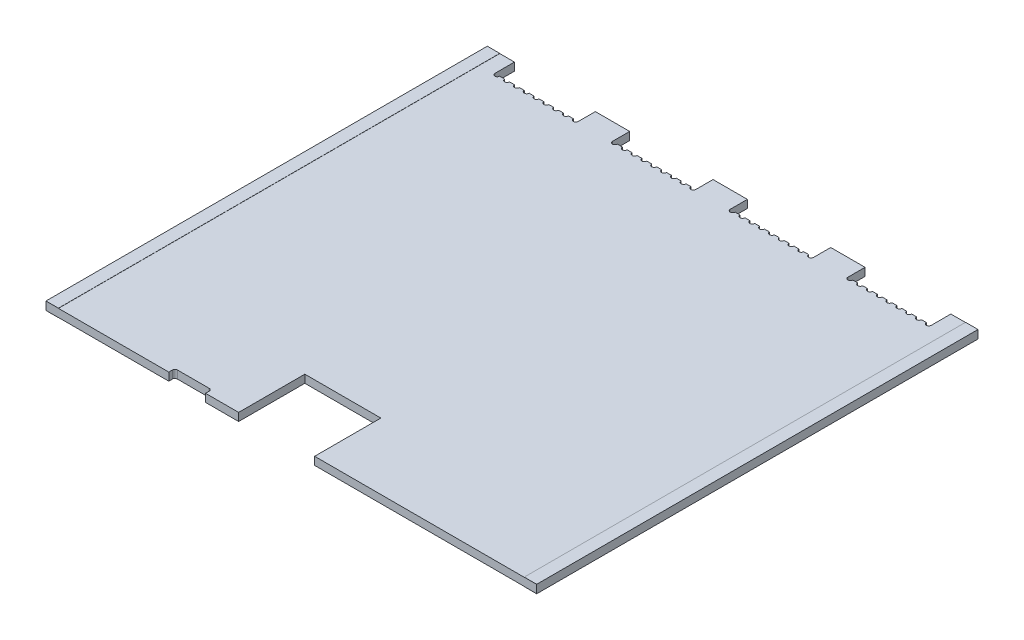
from build123d import *

# Parameters (mm, degrees)
FR4_DEPTH            = 1.61544
GOLD_PLATING_DEPTH   = 90
GOLD_PLATING_2_DEPTH = 90


with BuildPart() as part:
    # Sketch1 → FR4 (new body)
    with BuildSketch(Plane(origin=(0, 0, 0), x_dir=(1, 0, 0), z_dir=(0, 1, 0))):
        with BuildLine():
            Line((39.25, 0), (39.25, 13.5))
            Line((39.25, 13.5), (54.75, 13.5))
            Line((54.75, 13.5), (54.75, 0))
            Line((54.75, 0), (100, 0))
            Line((100, 0), (100, 90))
            Line((100, 90), (94.5, 90))
            Line((94.5, 90), (94.5, 86))
            ThreePointArc((94.5, 86), (94, 85.5), (93.5, 86))
            Line((93.5, 86), (92.5, 86))
            ThreePointArc((92.5, 86), (92, 85.5), (91.5, 86))
            Line((91.5, 86), (90.5, 86))
            ThreePointArc((90.5, 86), (90, 85.5), (89.5, 86))
            Line((89.5, 86), (88.5, 86))
            ThreePointArc((88.5, 86), (88, 85.5), (87.5, 86))
            Line((87.5, 86), (86.5, 86))
            ThreePointArc((86.5, 86), (86, 85.5), (85.5, 86))
            Line((85.5, 86), (84.5, 86))
            ThreePointArc((84.5, 86), (84, 85.5), (83.5, 86))
            Line((83.5, 86), (82.5, 86))
            ThreePointArc((82.5, 86), (82, 85.5), (81.5, 86))
            Line((81.5, 86), (80.5, 86))
            ThreePointArc((80.5, 86), (80, 85.5), (79.5, 86))
            Line((79.5, 86), (78.5, 86))
            ThreePointArc((78.5, 86), (78, 85.5), (77.5, 86))
            Line((77.5, 86), (77.5, 89.5))
            Line((77.5, 89.5), (70.5, 89.5))
            Line((70.5, 89.5), (70.5, 86))
            ThreePointArc((70.5, 86), (70, 85.5), (69.5, 86))
            Line((69.5, 86), (68.5, 86))
            ThreePointArc((68.5, 86), (68, 85.5), (67.5, 86))
            Line((67.5, 86), (66.5, 86))
            ThreePointArc((66.5, 86), (66, 85.5), (65.5, 86))
            Line((65.5, 86), (64.5, 86))
            ThreePointArc((64.5, 86), (64, 85.5), (63.5, 86))
            Line((63.5, 86), (62.5, 86))
            ThreePointArc((62.5, 86), (62, 85.5), (61.5, 86))
            Line((61.5, 86), (60.5, 86))
            ThreePointArc((60.5, 86), (60, 85.5), (59.5, 86))
            Line((59.5, 86), (58.5, 86))
            ThreePointArc((58.5, 86), (58, 85.5), (57.5, 86))
            Line((57.5, 86), (56.5, 86))
            ThreePointArc((56.5, 86), (56, 85.5), (55.5, 86))
            Line((55.5, 86), (54.5, 86))
            ThreePointArc((54.5, 86), (54, 85.5), (53.5, 86))
            Line((53.5, 86), (53.5, 89.5))
            Line((53.5, 89.5), (46.5, 89.5))
            Line((46.5, 89.5), (46.5, 86))
            ThreePointArc((46.5, 86), (46, 85.5), (45.5, 86))
            Line((45.5, 86), (44.5, 86))
            ThreePointArc((44.5, 86), (44, 85.5), (43.5, 86))
            Line((43.5, 86), (42.5, 86))
            ThreePointArc((42.5, 86), (42, 85.5), (41.5, 86))
            Line((41.5, 86), (40.5, 86))
            ThreePointArc((40.5, 86), (40, 85.5), (39.5, 86))
            Line((39.5, 86), (38.5, 86))
            ThreePointArc((38.5, 86), (38, 85.5), (37.5, 86))
            Line((37.5, 86), (36.5, 86))
            ThreePointArc((36.5, 86), (36, 85.5), (35.5, 86))
            Line((35.5, 86), (34.5, 86))
            ThreePointArc((34.5, 86), (34, 85.5), (33.5, 86))
            Line((33.5, 86), (32.5, 86))
            ThreePointArc((32.5, 86), (32, 85.5), (31.5, 86))
            Line((31.5, 86), (30.5, 86))
            ThreePointArc((30.5, 86), (30, 85.5), (29.5, 86))
            Line((29.5, 86), (29.5, 89.5))
            Line((29.5, 89.5), (22.5, 89.5))
            Line((22.5, 89.5), (22.5, 86))
            ThreePointArc((22.5, 86), (22, 85.5), (21.5, 86))
            Line((21.5, 86), (20.5, 86))
            ThreePointArc((20.5, 86), (20, 85.5), (19.5, 86))
            Line((19.5, 86), (18.5, 86))
            ThreePointArc((18.5, 86), (18, 85.5), (17.5, 86))
            Line((17.5, 86), (16.5, 86))
            ThreePointArc((16.5, 86), (16, 85.5), (15.5, 86))
            Line((15.5, 86), (14.5, 86))
            ThreePointArc((14.5, 86), (14, 85.5), (13.5, 86))
            Line((13.5, 86), (12.5, 86))
            ThreePointArc((12.5, 86), (12, 85.5), (11.5, 86))
            Line((11.5, 86), (10.5, 86))
            ThreePointArc((10.5, 86), (10, 85.5), (9.5, 86))
            Line((9.5, 86), (8.5, 86))
            ThreePointArc((8.5, 86), (8, 85.5), (7.5, 86))
            Line((7.5, 86), (6.5, 86))
            ThreePointArc((6.5, 86), (6, 85.5), (5.5, 86))
            Line((5.5, 86), (5.5, 90))
            Line((5.5, 90), (0, 90))
            Line((0, 90), (0, 0))
            Line((0, 0), (13.5, 0))
            Line((13.5, 0), (25, 0))
            Line((25, 0), (25, 0.75))
            ThreePointArc((25, 0.75), (25.146446609, 1.103553391), (25.5, 1.25))
            Line((25.5, 1.25), (32, 1.25))
            ThreePointArc((32, 1.25), (32.353553391, 1.103553391), (32.5, 0.75))
            Line((32.5, 0.75), (32.5, 0))
            Line((32.5, 0), (39.25, 0))
        make_face()
    extrude(amount=FR4_DEPTH)


with BuildPart() as body_2:
    # Sketch2 → gold-plating (new, through all)
    with BuildSketch(Plane.XY):
        Polygon((2.5, 1.61544), (2.5, 1.651), (-0.03556, 1.651), (-0.03556, -0.03556), (2.5, -0.03556), (2.5, 0), (0, 0), (0, 1.61544), align=None)
    extrude(amount=-GOLD_PLATING_DEPTH)


with BuildPart() as body_3:
    # Sketch2 → gold-plating 2 (new, through all)
    with BuildSketch(Plane.XY):
        Polygon((100, 1.61544), (100, 0), (97.5, 0), (97.5, -0.03556), (100.03556, -0.03556), (100.03556, 1.651), (97.5, 1.651), (97.5, 1.61544), align=None)
    extrude(amount=-GOLD_PLATING_2_DEPTH)


solid = Compound([part.part, body_2.part, body_3.part])
